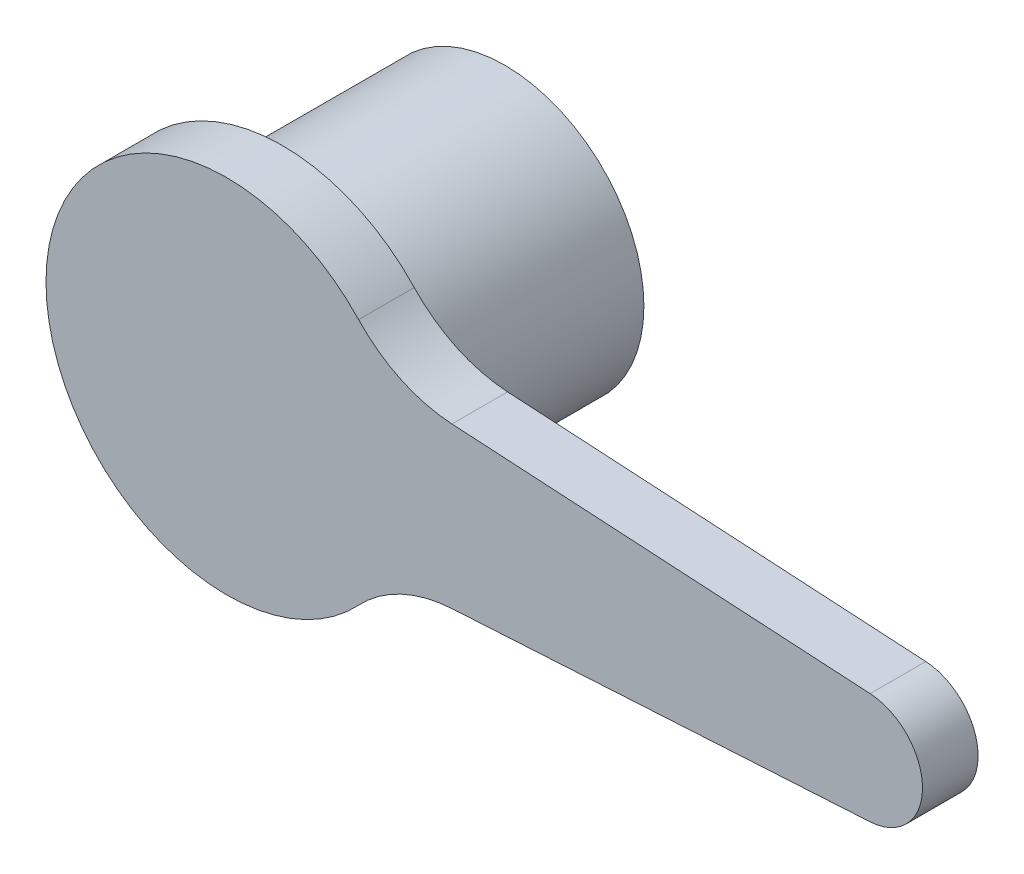
from build123d import *

# Parameters (mm, degrees)
BOSS_EXTRUDE1_DEPTH = 20
CUT_EXTRUDE1_DEPTH  = 10
SKETCH9_R           = 50
BOSS_EXTRUDE4_DEPTH = 80
CUT_EXTRUDE4_DEPTH  = 75


with BuildPart() as part:
    # Sketch3 → Boss-Extrude1 (new body)
    with BuildSketch(Plane.XY):
        with BuildLine():
            Line((231.34250824, 19.965947877), (80.967339763, 28.752193652))
            ThreePointArc((80.967339763, 28.752193652), (62.680914893, 33.385308199), (47.412586794, 44.463992326))
            ThreePointArc((47.412586794, 44.463992326), (-65, 0), (47.412586794, -44.463992326))
            ThreePointArc((47.412586794, -44.463992326), (62.680914893, -33.385308199), (80.967339763, -28.752193652))
            Line((80.967339763, -28.752193652), (231.34250824, -19.965947877))
            ThreePointArc((231.34250824, -19.965947877), (250.175921184, 0), (231.34250824, 19.965947877))
        make_face()
    extrude(amount=BOSS_EXTRUDE1_DEPTH)

    # Sketch4 → Cut-Extrude1 (cut)
    with BuildSketch(Plane(origin=(0, 0, 0), x_dir=(-1, 0, 0), z_dir=(0, 0, -1))):
        with BuildLine():
            Line((-231.376219968, -12.442237854), (-102.400597569, -24.884475709))
            ThreePointArc((-102.400597569, -24.884475709), (-75, 0), (-102.400597569, 24.884475709))
            Line((-102.400597569, 24.884475709), (-231.376219968, 12.442237854))
            ThreePointArc((-231.376219968, 12.442237854), (-242.675921184, 0), (-231.376219968, -12.442237854))
        make_face()
    extrude(amount=-CUT_EXTRUDE1_DEPTH, mode=Mode.SUBTRACT)

    # Sketch9 → Boss-Extrude4 (add)
    with BuildSketch(Plane(origin=(0, 0, 0), x_dir=(-1, 0, 0), z_dir=(0, 0, -1))):
        with Locations(Location((0, 0, 0), (0, 0, 180))):
            Circle(SKETCH9_R)
    extrude(amount=BOSS_EXTRUDE4_DEPTH)

    # Sketch10 → Cut-Extrude4 (cut)
    with BuildSketch(Plane(origin=(0, 0, -80), x_dir=(-1, 0, 0), z_dir=(0, 0, -1))):
        Polygon((0, 46.188021535), (-40, 23.094010768), (-40, -23.094010768), (0, -46.188021535), (40, -23.094010768), (40, 23.094010768), align=None)
    extrude(amount=-CUT_EXTRUDE4_DEPTH, mode=Mode.SUBTRACT)


solid = part.part
